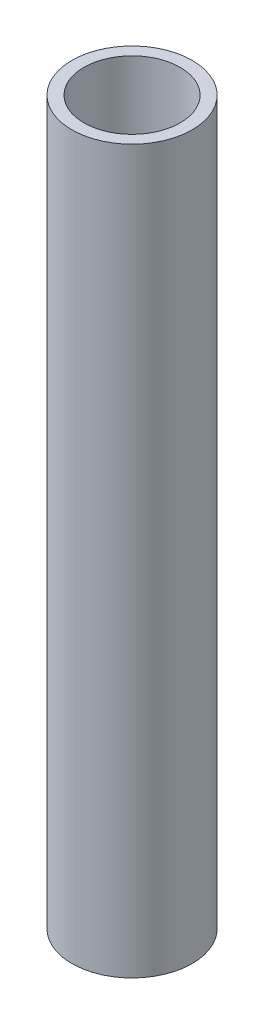
from build123d import *

# Parameters (mm, degrees)
SKETCH1_R           = 3.175
SKETCH1_R_2         = 2.54
BOSS_EXTRUDE1_DEPTH = 38.1


with BuildPart() as part:
    # Sketch1 → Boss-Extrude1 (new body)
    with BuildSketch(Plane(origin=(0, 0, 0), x_dir=(1, 0, 0), z_dir=(0, 1, 0))):
        Circle(SKETCH1_R)
        Circle(SKETCH1_R_2, mode=Mode.SUBTRACT)
    extrude(amount=BOSS_EXTRUDE1_DEPTH)


solid = part.part
